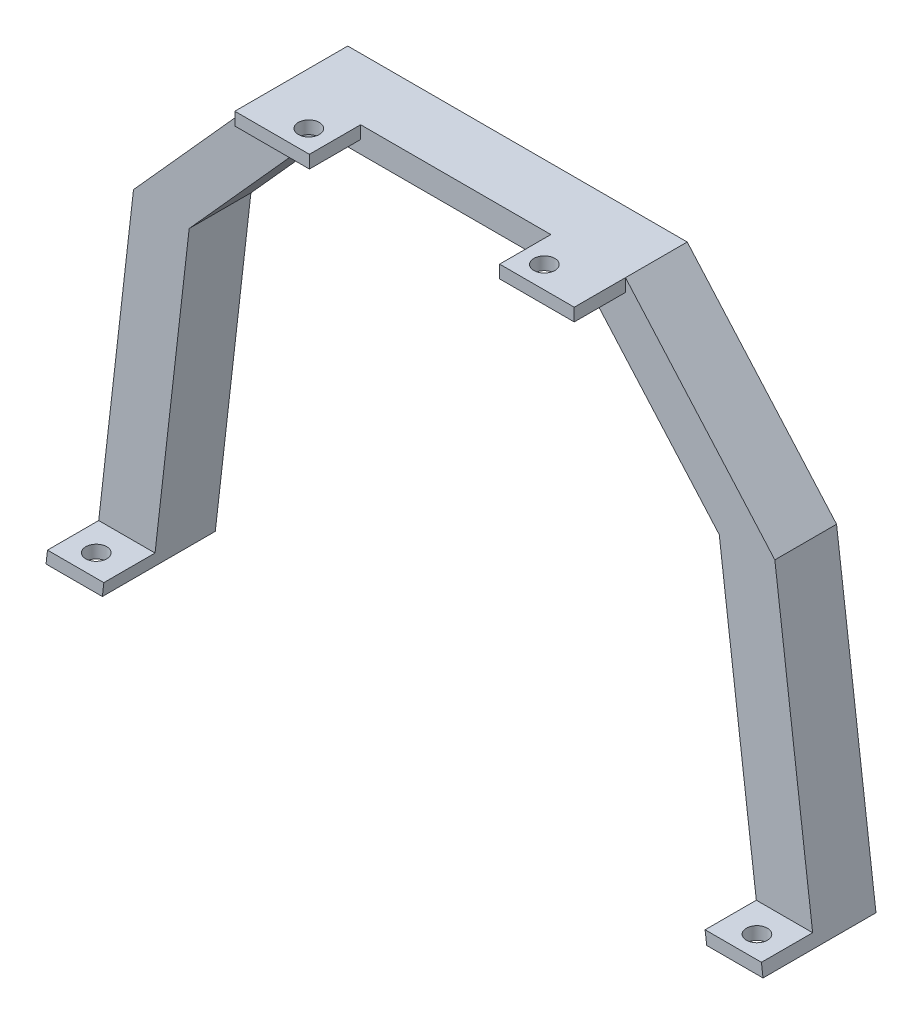
from build123d import *

# Parameters (mm, degrees)
BOSS_EXTRUDE1_DEPTH      = 10
BOSS_EXTRUDE1_DEPTH_BACK = 2.055125775
BOSS_EXTRUDE2_DEPTH      = 10
SKETCH3_R                = 2.05
CUT_EXTRUDE1_DEPTH       = 10
SKETCH4_W                = 14.568281885
SKETCH4_H                = 2.5
BOSS_EXTRUDE3_DEPTH      = 10
SKETCH6_R                = 2.05
CUT_EXTRUDE2_DEPTH       = 10


with BuildPart() as part:
    # Sketch1 → Boss-Extrude1 (new, two sides: drawn at the far end of the back side and taken through both)
    with BuildSketch(Plane.XY.offset(-BOSS_EXTRUDE1_DEPTH_BACK)):
        Polygon((0, 0), (-11, 0), (-3.916610397, 61.857854845), (25.860231814, 95), (92.139768186, 95), (121.30603718, 61.857854845), (129, 0), (118, 0), (110.448917943, 60.709123335), (84.671902488, 90), (33.26848477, 90), (6.951847491, 60.709123335), align=None)
    extrude(amount=BOSS_EXTRUDE1_DEPTH + BOSS_EXTRUDE1_DEPTH_BACK)

    # Sketch2 → Boss-Extrude2 (add)
    with BuildSketch(Plane.XY.offset(10)):
        Polygon((-11, 0), (0, 0), (0.286276885, 2.5), (-10.713723115, 2.5), align=None)
        Polygon((118, 0), (129, 0), (128.689046652, 2.5), (117.689046652, 2.5), align=None)
    extrude(amount=BOSS_EXTRUDE2_DEPTH)

    # Sketch3 → Cut-Extrude1 (cut)
    with BuildSketch(Plane(origin=(0, 2.5, 0), x_dir=(1, 0, 0), z_dir=(0, 1, 0))):
        with Locations(Location((-5.5, -15.687372709, 0), (0, 0, 180))):
            Circle(SKETCH3_R)
        with Locations(Location((123.5, -15.687372709, 0), (0, 0, 180))):
            Circle(SKETCH3_R)
    extrude(amount=-CUT_EXTRUDE1_DEPTH, mode=Mode.SUBTRACT)

    # Sketch4 → Boss-Extrude3 (add)
    with BuildSketch(Plane.XY.offset(10)):
        with Locations((33.144372757, 93.75)):
            Rectangle(SKETCH4_W, SKETCH4_H)
        with Locations((84.855627244, 93.75)):
            Rectangle(SKETCH4_W, SKETCH4_H)
    extrude(amount=BOSS_EXTRUDE3_DEPTH)

    # Sketch6 → Cut-Extrude2 (cut)
    with BuildSketch(Plane(origin=(0, 95, 0), x_dir=(1, 0, 0), z_dir=(0, 1, 0))):
        with Locations(Location((36, -15.687372709, 0), (0, 0, 270))):
            Circle(SKETCH6_R)
        with Locations(Location((82, -15.687372709, 0), (0, 0, 270))):
            Circle(SKETCH6_R)
    extrude(amount=-CUT_EXTRUDE2_DEPTH, mode=Mode.SUBTRACT)


solid = part.part
